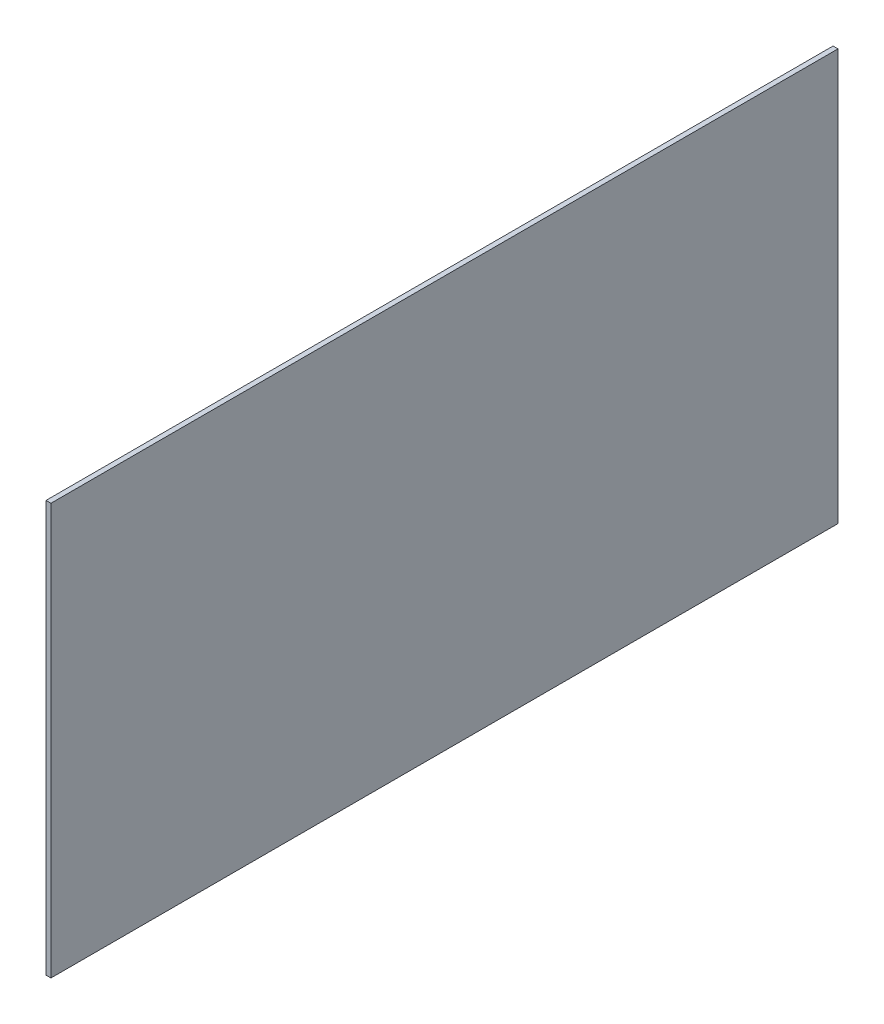
from build123d import *

# Parameters (mm, degrees)
SKETCH1_W           = 425.45
SKETCH1_H           = 222.25
BOSS_EXTRUDE1_DEPTH = 2.667


with BuildPart() as part:
    # Sketch1 → Boss-Extrude1 (new body)
    with BuildSketch(Plane(origin=(0, 0, 0), x_dir=(0, 0, -1), z_dir=(1, 0, 0))):
        with Locations((-328.295, 111.125)):
            Rectangle(SKETCH1_W, SKETCH1_H)
    extrude(amount=BOSS_EXTRUDE1_DEPTH)


solid = part.part
